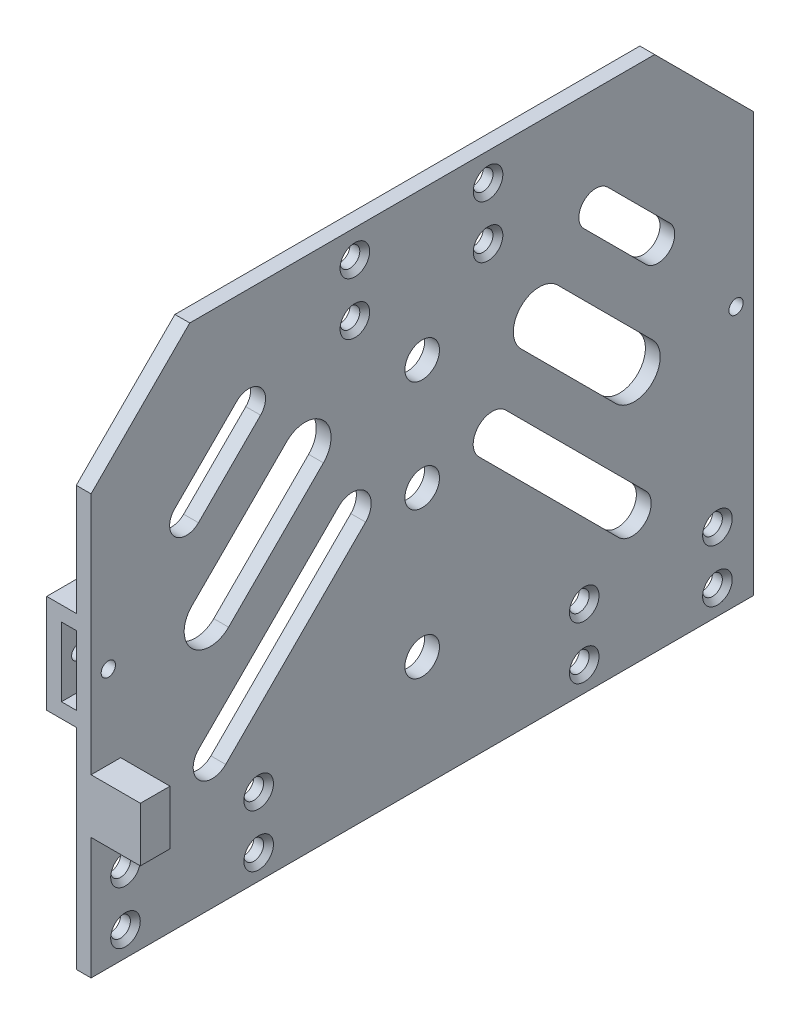
from build123d import *

# Parameters (mm, degrees)
SKETCH_1_R          = 2
EXTRUDE_1_DEPTH     = 3
EXTRUDE_2_DEPTH     = 10
SKETCH_9_R          = 3.5
CUT_EXTRUDE_3_DEPTH = 4
CHAMFER_1_SIZE      = 1
EXTRUDE_3_DEPTH     = 6
SKETCH_11_W         = 3
SKETCH_11_H         = 14
CUT_EXTRUDE_4_DEPTH = 162.773826789
SKETCH_12_R         = 1.45
CUT_EXTRUDE_5_DEPTH = 157.648043168


with BuildPart() as part:
    # Эскиз1 → Бобышка-Вытянуть1 (new body)
    with BuildSketch(Plane(origin=(0, 0, 0), x_dir=(0, 0, -1), z_dir=(1, 0, 0))):
        Polygon((-6.974965275, 89.32), (-6.974965275, -10.68), (-6.974965275, -15.68), (0, -15.68), (127.277441161, -15.68), (127.277441161, 89.32), align=None)
        with BuildLine():
            ThreePointArc((2, -10.68), (0, -12.68), (-2, -10.68))
            ThreePointArc((-2, -10.68), (0, -8.68), (2, -10.68))
        make_face(mode=Mode.SUBTRACT)
        Circle(SKETCH_1_R, mode=Mode.SUBTRACT)
        with Locations((27, -10.68)):
            Circle(SKETCH_1_R, mode=Mode.SUBTRACT)
        with Locations((27, 0)):
            Circle(SKETCH_1_R, mode=Mode.SUBTRACT)
        with Locations((93, -10.68)):
            Circle(SKETCH_1_R, mode=Mode.SUBTRACT)
        with Locations((93, 0)):
            Circle(SKETCH_1_R, mode=Mode.SUBTRACT)
        with Locations((120, -10.68)):
            Circle(SKETCH_1_R, mode=Mode.SUBTRACT)
        with Locations((120, 0)):
            Circle(SKETCH_1_R, mode=Mode.SUBTRACT)
        with Locations((46.5, 73)):
            Circle(SKETCH_1_R, mode=Mode.SUBTRACT)
        with Locations((46.5, 83.68)):
            Circle(SKETCH_1_R, mode=Mode.SUBTRACT)
        with Locations((73.5, 73)):
            Circle(SKETCH_1_R, mode=Mode.SUBTRACT)
        with Locations((73.5, 83.68)):
            Circle(SKETCH_1_R, mode=Mode.SUBTRACT)
    extrude(amount=EXTRUDE_1_DEPTH)

    # Эскиз2 → Бобышка-Вытянуть2 (add)
    with BuildSketch(Plane(origin=(3, 0, 0), x_dir=(0, 0, -1), z_dir=(1, 0, 0))):
        Polygon((-6.974965275, 20), (-6.974965275, 9.003796157), (-4.947379944, 9.003796157), (-0.974965275, 9.003796157), (-0.974965275, 20), (-4.947379944, 20), align=None)
    extrude(amount=EXTRUDE_2_DEPTH)

    # Эскиз9 → Вырез-Вытянуть3 (cut)
    with BuildSketch(Plane(origin=(3, 0, 0), x_dir=(0, 0, -1), z_dir=(1, 0, 0))):
        with BuildLine():
            Line((22.546175163, 70.795026635), (9.952666032, 58.201517504))
            ThreePointArc((9.952666032, 58.201517504), (9.952666032, 53.360356634), (14.793826902, 53.360356634))
            Line((14.793826902, 53.360356634), (27.387336033, 65.953865765))
            ThreePointArc((27.387336033, 65.953865765), (27.387336033, 70.795026635), (22.546175163, 70.795026635))
        make_face()
        with BuildLine():
            Line((32.678333733, 58.660989456), (13.446318476, 39.428974199))
            ThreePointArc((13.446318476, 39.428974199), (13.446318476, 31.977379799), (20.897912876, 31.977379799))
            Line((20.897912876, 31.977379799), (40.129928133, 51.209395056))
            ThreePointArc((40.129928133, 51.209395056), (40.129928133, 58.660989456), (32.678333733, 58.660989456))
        make_face()
        with BuildLine():
            Line((43.218387294, 41.992648329), (14.858440337, 13.632701372))
            ThreePointArc((14.858440337, 13.632701372), (14.858440337, 8.171706676), (20.319435032, 8.171706676))
            Line((20.319435032, 8.171706676), (48.67938199, 36.531653634))
            ThreePointArc((48.67938199, 36.531653634), (48.67938199, 41.992648329), (43.218387294, 41.992648329))
        make_face()
        with Locations((60.151237943, 7.166059051)):
            Circle(SKETCH_9_R)
        Polygon((-6.974965275, 69.32), (13.025034725, 89.32), (-6.974965275, 89.32), align=None)
        Polygon((127.277441161, 89.32), (107.277441161, 89.32), (127.277441161, 69.32), align=None)
        with Locations((60.151237943, 59.280937069)):
            Circle(SKETCH_9_R)
        with Locations((60.151237943, 36.82)):
            Circle(SKETCH_9_R)
        with BuildLine():
            ThreePointArc((99.983040853, 8.171706676), (105.444035549, 8.171706676), (105.444035549, 13.632701372))
            Line((105.444035549, 13.632701372), (77.084088591, 41.992648329))
            ThreePointArc((77.084088591, 41.992648329), (71.623093896, 41.992648329), (71.623093896, 36.531653634))
            Line((71.623093896, 36.531653634), (99.983040853, 8.171706676))
        make_face()
        with BuildLine():
            ThreePointArc((99.40456301, 31.977379799), (106.85615741, 31.977379799), (106.85615741, 39.428974199))
            Line((106.85615741, 39.428974199), (87.624142153, 58.660989456))
            ThreePointArc((87.624142153, 58.660989456), (80.172547753, 58.660989456), (80.172547753, 51.209395056))
            Line((80.172547753, 51.209395056), (99.40456301, 31.977379799))
        make_face()
        with BuildLine():
            ThreePointArc((105.508648984, 53.360356634), (110.349809854, 53.360356634), (110.349809854, 58.201517504))
            Line((110.349809854, 58.201517504), (97.756300723, 70.795026635))
            ThreePointArc((97.756300723, 70.795026635), (92.915139853, 70.795026635), (92.915139853, 65.953865765))
            Line((92.915139853, 65.953865765), (105.508648984, 53.360356634))
        make_face()
    extrude(amount=-CUT_EXTRUDE_3_DEPTH, mode=Mode.SUBTRACT)

    # Фаска1
    chamfer_1_edges = [part.edges().sort_by_distance(p)[0] for p in [
        (3, -10.68, -118),
        (3, 0, -118),
        (3, -10.68, -91),
        (3, 0, -91),
        (3, 0, 2),
        (3, -10.68, 2),
        (3, -10.68, -25),
        (3, 0, -25),
        (3, 73, -44.5),
        (3, 73, -71.5),
        (3, 83.68, -71.5),
        (3, 83.68, -44.5),
    ]]
    chamfer(chamfer_1_edges, length=CHAMFER_1_SIZE)

    # Эскиз10 → Бобышка-Вытянуть3 (add)
    with BuildSketch(Plane.ZY):
        Polygon((-127.277441161, 36.82), (-127.277441161, 46.82), (-120.277441161, 46.82), (-120.277441161, 26.82), (-127.277441161, 26.82), align=None)
        Polygon((-0.025034725, 26.82), (6.974965275, 26.82), (6.974965275, 36.82), (6.974965275, 46.82), (-0.025034725, 46.82), align=None)
    extrude(amount=EXTRUDE_3_DEPTH)

    # Эскиз11 → Вырез-Вытянуть4 (cut, through all)
    with BuildSketch(Plane(origin=(0, 0, -127.277441161), x_dir=(-1, 0, 0), z_dir=(0, 0, -1))):
        with Locations((1.5, 36.82)):
            Rectangle(SKETCH_11_W, SKETCH_11_H)
    extrude(amount=-CUT_EXTRUDE_4_DEPTH, mode=Mode.SUBTRACT)

    # Эскиз12 → Вырез-Вытянуть5 (cut, through all)
    with BuildSketch(Plane.ZY.offset(6)):
        with Locations((-123.777441161, 36.82)):
            Circle(SKETCH_12_R)
        with Locations((3.474965275, 36.82)):
            Circle(SKETCH_12_R)
    extrude(amount=-CUT_EXTRUDE_5_DEPTH, mode=Mode.SUBTRACT)


solid = part.part
